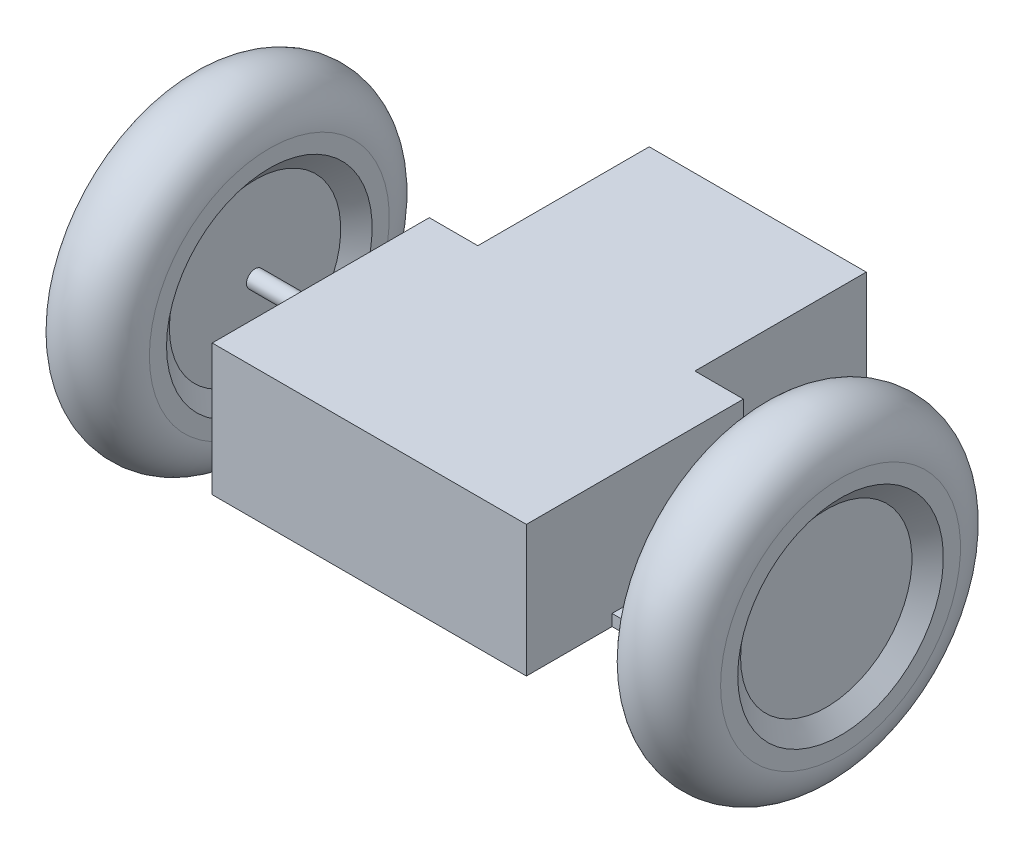
from build123d import *

# Parameters (mm, degrees)
BOSS_EXTRUDE1_DEPTH      = 11.5
BOSS_EXTRUDE1_DEPTH_BACK = 11.5
SKETCH1_W                = 55
SKETCH1_H                = 68
SKETCH2_R                = 1.5
BOSS_EXTRUDE2_DEPTH      = 15
SKETCH7_W                = 8.5
SKETCH7_H                = 30
CUT_EXTRUDE1_DEPTH       = 80.451243008
SKETCH8_W                = 5
SKETCH8_H                = 8
SKETCH8_R                = 1.5
BOSS_EXTRUDE3_DEPTH      = 2


with BuildPart() as part:
    # Sketch1 → Boss-Extrude1 (new, two sides: drawn at the far end of the back side and taken through both)
    with BuildSketch(Plane(origin=(0, 0, 0), x_dir=(1, 0, 0), z_dir=(0, 1, 0)).offset(-BOSS_EXTRUDE1_DEPTH_BACK)):
        Rectangle(SKETCH1_W, SKETCH1_H)
    extrude(amount=BOSS_EXTRUDE1_DEPTH + BOSS_EXTRUDE1_DEPTH_BACK)

    # Sketch2 → Boss-Extrude2 (add)
    with BuildSketch(Plane(origin=(27.5, 0, 0), x_dir=(0, 0, -1), z_dir=(1, 0, 0))):
        with Locations((-9, 0)):
            Circle(SKETCH2_R)
    boss_extrude2 = extrude(amount=BOSS_EXTRUDE2_DEPTH)

    # Sketch6 → Revolve1 (revolve)
    with BuildSketch(Plane(origin=(0, 0, 0), x_dir=(1, 0, 0), z_dir=(0, 1, 0))):
        with BuildLine():
            Line((42.5, -7.5), (45, -7.5))
            Line((45, -7.5), (45, 6))
            Line((45, 6), (42.5, 9))
            Line((42.5, 9), (42.5, 12))
            ThreePointArc((42.5, 12), (50, 19.5), (57.5, 12))
            Line((57.5, 12), (57.5, 9))
            Line((57.5, 9), (55, 6))
            Line((55, 6), (55, -9))
            Line((55, -9), (42.5, -9))
            Line((42.5, -9), (42.5, -7.5))
        make_face()
    revolve1 = revolve(axis=Axis((42.5, 0, 9), (1, 0, 0)))

    # Mirror1: Boss-Extrude2, Revolve1 across plane
    add(boss_extrude2.mirror(Plane(origin=(0, 0, 0), x_dir=(0, 0, 1), z_dir=(1, 0, 0))))
    add(revolve1.mirror(Plane(origin=(0, 0, 0), x_dir=(0, 0, 1), z_dir=(1, 0, 0))))

    # Sketch7 → Cut-Extrude1 (cut, through all)
    with BuildSketch(Plane(origin=(0, 11.5, 0), x_dir=(1, 0, 0), z_dir=(0, 1, 0))):
        with Locations((-23.25, 19)):
            Rectangle(SKETCH7_W, SKETCH7_H)
        with Locations((23.25, 19)):
            Rectangle(SKETCH7_W, SKETCH7_H)
    extrude(amount=-CUT_EXTRUDE1_DEPTH, mode=Mode.SUBTRACT)

    # Sketch8 → Boss-Extrude3 (add)
    # profile 1 of 2: a face of its own
    with BuildSketch(Plane.XZ.offset(11.5)):
        with Locations((-30, 15)):
            Rectangle(SKETCH8_W, SKETCH8_H)
        with Locations((-30, 15)):
            Circle(SKETCH8_R, mode=Mode.SUBTRACT)
    # profile 2 of 2: a face of its own
    with BuildSketch(Plane.XZ.offset(11.5)):
        with Locations((30, 15)):
            Rectangle(SKETCH8_W, SKETCH8_H)
        with Locations((30, 15)):
            Circle(SKETCH8_R, mode=Mode.SUBTRACT)
    extrude(amount=-BOSS_EXTRUDE3_DEPTH)


solid = part.part
